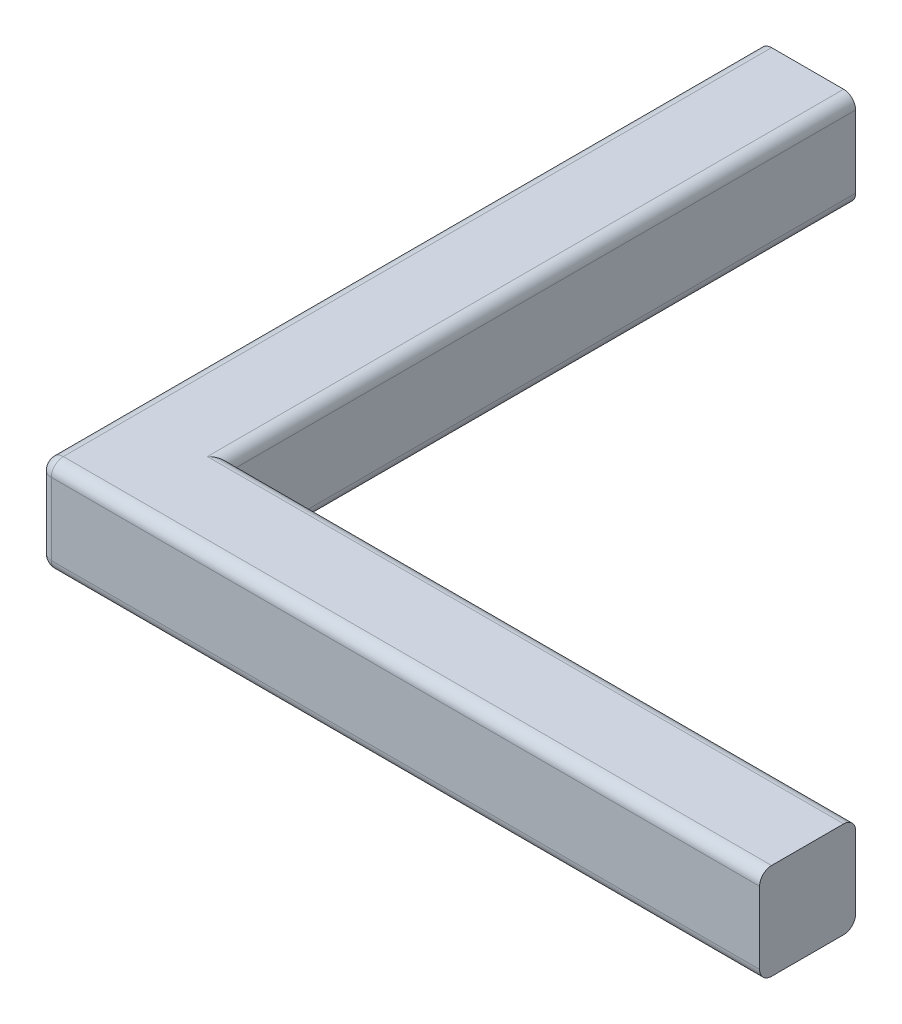
from build123d import *

# Parameters (mm, degrees)
BOSS_EXTRUDE1_DEPTH = 40
FILLET1_R           = 5
FILLET2_R           = 5
FILLET3_R           = 5


with BuildPart() as part:
    # Sketch1 → Boss-Extrude1 (new body)
    with BuildSketch(Plane(origin=(0, 0, 0), x_dir=(1, 0, 0), z_dir=(0, 1, 0))):
        Polygon((0, 0), (300, 0), (300, 40), (40, 40), (40, 300), (0, 300), (0, 40), align=None)
    extrude(amount=BOSS_EXTRUDE1_DEPTH)

    # Fillet1
    fillet1_edges = [part.edges().sort_by_distance(p)[0] for p in [
        (150, 40, 0),
    ]]
    fillet(fillet1_edges, radius=FILLET1_R)

    # Fillet2
    fillet2_edges = [part.edges().sort_by_distance(p)[0] for p in [
        (170, 40, -40),
        (40, 40, -170),
        (40, 0, -170),
        (150, 0, 0),
    ]]
    fillet(fillet2_edges, radius=FILLET2_R)

    # Fillet3
    fillet3_edges = [part.edges().sort_by_distance(p)[0] for p in [
        (0, 1.464466094, -1.464466094),
        (0, 20, 0),
        (0, 38.535533906, -1.464466094),
        (167.5, 0, -40),
        (0, 0, -152.5),
        (0, 40, -152.5),
    ]]
    fillet(fillet3_edges, radius=FILLET3_R)


solid = part.part
